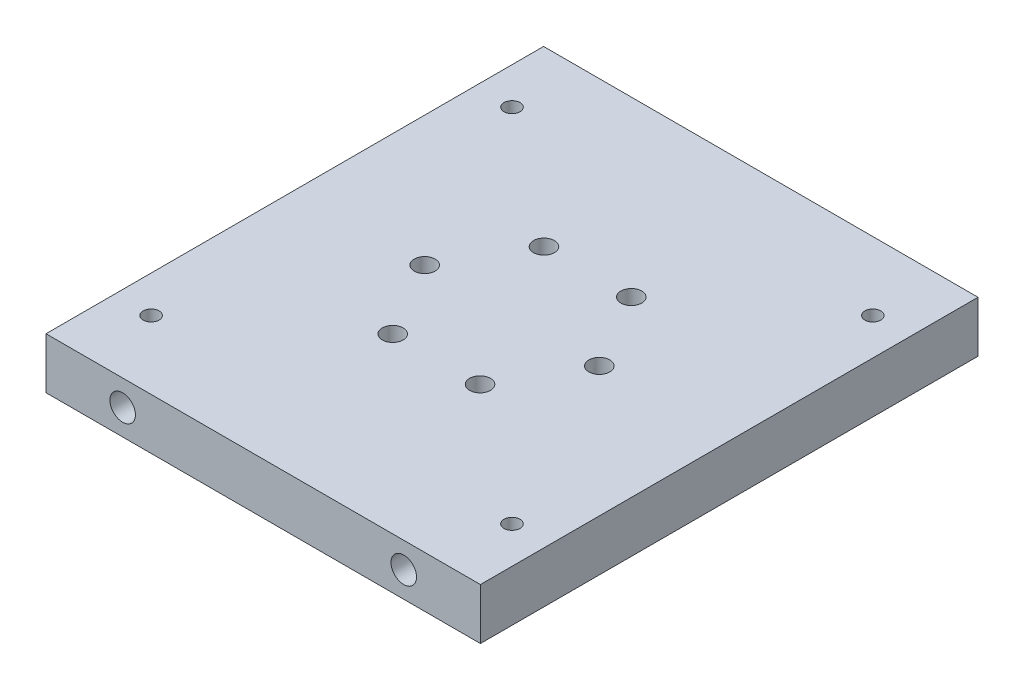
from build123d import *

# Parameters (mm, degrees)
SKETCH1_W           = 107.95
SKETCH1_H           = 12.7
BOSS_EXTRUDE1_DEPTH = 123.65
SKETCH2_R           = 3.175
CUT_EXTRUDE1_DEPTH  = 25.4
SKETCH4_R           = 1.985
CUT_EXTRUDE3_DEPTH  = 165.632363161
SKETCH6_R           = 2.6
CUT_EXTRUDE8_DEPTH  = 165.632363161


with BuildPart() as part:
    # Sketch1 → Boss-Extrude1 (new body)
    with BuildSketch(Plane.XY):
        with Locations((53.975, -6.35)):
            Rectangle(SKETCH1_W, SKETCH1_H)
    extrude(amount=BOSS_EXTRUDE1_DEPTH)

    # Sketch2 → Cut-Extrude1 (cut)
    with BuildSketch(Plane.XY.offset(123.65)):
        with Locations((19.05, -6.35)):
            Circle(SKETCH2_R)
        with Locations((88.9, -6.35)):
            Circle(SKETCH2_R)
    cut_extrude1 = extrude(amount=-CUT_EXTRUDE1_DEPTH, mode=Mode.SUBTRACT)

    # Mirror1: Cut-Extrude1 across plane
    add(cut_extrude1.mirror(Plane.XY.offset(61.825)), mode=Mode.SUBTRACT)

    # Sketch4 → Cut-Extrude3 (cut, through all)
    with BuildSketch(Plane(origin=(0, 0, 0), x_dir=(1, 0, 0), z_dir=(0, 1, 0))):
        with Locations(Location((9.135, -106.665, 0), (0, 0, 270))):
            Circle(SKETCH4_R)
        with Locations(Location((9.14, -16.99, 0), (0, 0, 270))):
            Circle(SKETCH4_R)
        with Locations(Location((98.81, -106.665, 0), (0, 0, 270))):
            Circle(SKETCH4_R)
        with Locations(Location((98.815, -16.99, 0), (0, 0, 270))):
            Circle(SKETCH4_R)
    extrude(amount=-CUT_EXTRUDE3_DEPTH, mode=Mode.SUBTRACT)

    # Sketch6 → Cut-Extrude8 (cut, through all)
    with BuildSketch(Plane(origin=(0, 0, 0), x_dir=(1, 0, 0), z_dir=(0, 1, 0))):
        with Locations(Location((32.275, -61.825, 0), (0, 0, 270))):
            Circle(SKETCH6_R)
        with Locations(Location((43.125, -43.032248738, 0), (0, 0, 270))):
            Circle(SKETCH6_R)
        with Locations(Location((64.825, -43.032248738, 0), (0, 0, 270))):
            Circle(SKETCH6_R)
        with Locations(Location((75.675, -61.825, 0), (0, 0, 270))):
            Circle(SKETCH6_R)
        with Locations(Location((64.825, -80.617751262, 0), (0, 0, 270))):
            Circle(SKETCH6_R)
        with Locations(Location((43.125, -80.617751262, 0), (0, 0, 270))):
            Circle(SKETCH6_R)
    extrude(amount=-CUT_EXTRUDE8_DEPTH, mode=Mode.SUBTRACT)


solid = part.part
